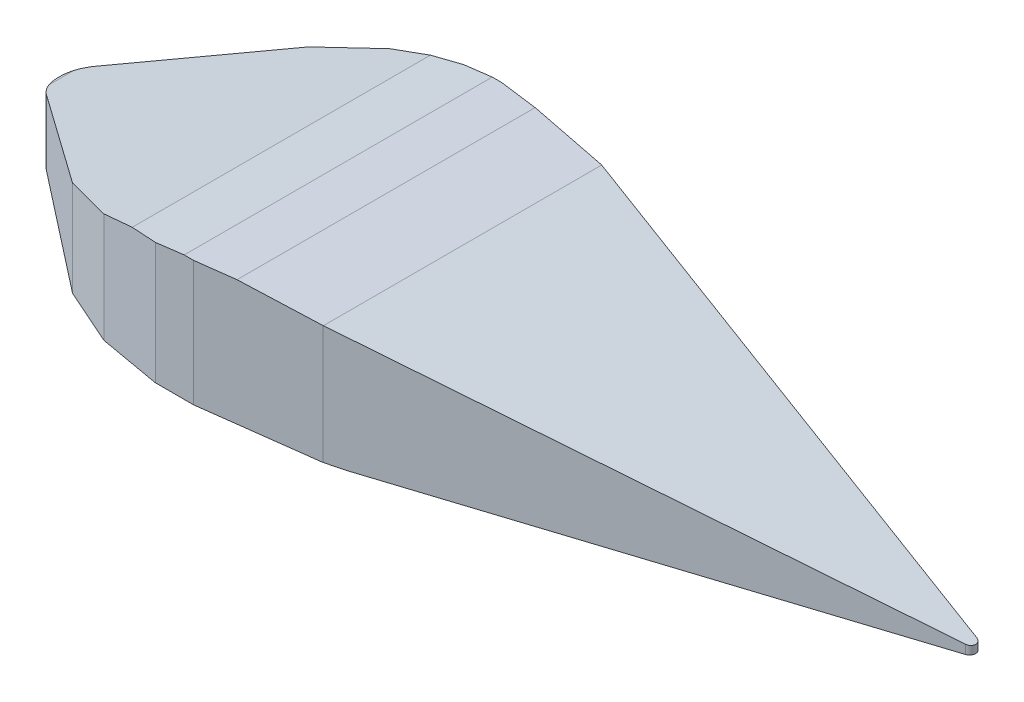
from build123d import *

# Parameters (mm, degrees)
TOPVIEW_EXTRUDE_DEPTH      = 800
SIDEPROFILE_CUT_DEPTH      = 4992.748078174
SIDEPROFILE_CUT_DEPTH_BACK = 4992.748078174
SKETCH2_OUTSIDE_W          = 5781.309
SKETCH2_OUTSIDE_H          = 1819.37


with BuildPart() as part:
    # Sketch1 → TopView_Extrude (new body)
    with BuildSketch(Plane(origin=(0, 0, 0), x_dir=(1, 0, 0), z_dir=(0, 1, 0))):
        with BuildLine():
            Line((161.409759475, 126.088702216), (784.13, 612.54))
            Line((784.13, 612.54), (1076.464, 742.696))
            Line((1076.464, 742.696), (1401.451, 800))
            Line((1401.451, 800), (1600, 800))
            Line((1600, 800), (2195.064, 723.196))
            Line((2195.064, 723.196), (4839.463434647, 29.016863519))
            ThreePointArc((4839.463434647, 29.016863519), (4861.846241497, 0), (4839.463434647, -29.016863519))
            Line((4839.463434647, -29.016863519), (2195.064, -723.196))
            Line((2195.064, -723.196), (1600, -800))
            Line((1600, -800), (1401.451, -800))
            Line((1401.451, -800), (1076.464, -742.696))
            Line((1076.464, -742.696), (784.13, -612.54))
            Line((784.13, -612.54), (161.409759475, -126.088702216))
            ThreePointArc((161.409759475, -126.088702216), (99.906658784, 0), (161.409759475, 126.088702216))
        make_face()
    extrude(amount=TOPVIEW_EXTRUDE_DEPTH)

    # Sketch2 outside → SideProfile_Cut (cut, two sides: drawn at the far end of the back side and taken through both)
    with BuildSketch(Plane.XY.offset(-SIDEPROFILE_CUT_DEPTH_BACK)):
        with Locations((2480.8765, 400)):
            Rectangle(SKETCH2_OUTSIDE_W, SKETCH2_OUTSIDE_H)
        with BuildLine():
            Line((0, 300), (0, 332.854109989))
            ThreePointArc((0, 332.854109989), (31.780435884, 425.180350356), (113.655128803, 478.384348558))
            Line((113.655128803, 478.384348558), (1255.921, 763.655))
            Line((1255.921, 763.655), (1551.451, 800))
            Line((1551.451, 800), (1800, 800))
            Line((1800, 800), (2197.056, 765.81))
            Line((2197.056, 765.81), (4950, 288.165))
            Line((4950, 288.165), (4950, 265.638))
            Line((4950, 265.638), (2301.451, 150))
            Line((2301.451, 150), (150, 150))
            ThreePointArc((150, 150), (43.933982822, 193.933982822), (0, 300))
        make_face(mode=Mode.SUBTRACT)
    extrude(amount=SIDEPROFILE_CUT_DEPTH + SIDEPROFILE_CUT_DEPTH_BACK, mode=Mode.SUBTRACT)


solid = part.part
